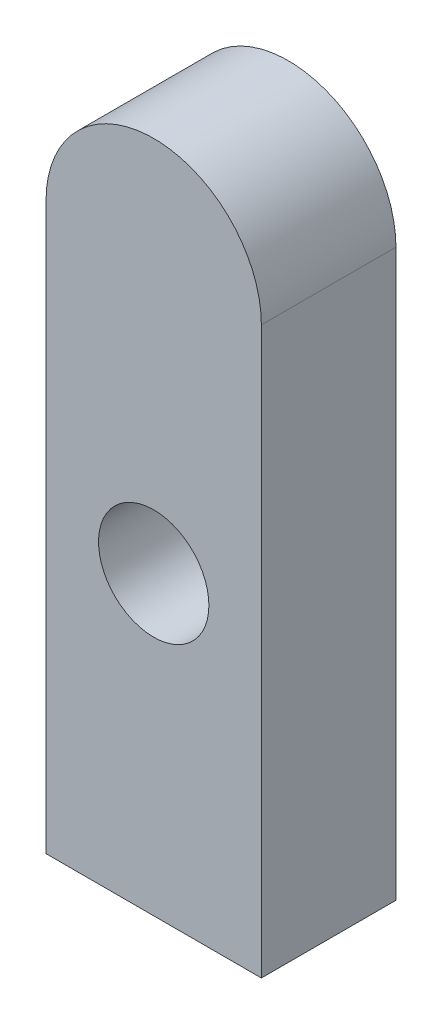
from build123d import *

# Parameters (mm, degrees)
SKETCH_1_R      = 2.05
EXTRUDE_1_DEPTH = 2.5


with BuildPart() as part:
    # 스케치1 → 보스-돌출1 (new, symmetric)
    with BuildSketch(Plane.XY):
        with BuildLine():
            Line((-4, 0), (-4, 10))
            ThreePointArc((-4, 10), (0, 14), (4, 10))
            Line((4, 10), (4, 0))
            Line((4, 0), (4, -11.014558485))
            Line((4, -11.014558485), (-4, -11.014558485))
            Line((-4, -11.014558485), (-4, 0))
        make_face()
        Circle(SKETCH_1_R, mode=Mode.SUBTRACT)
    extrude(amount=EXTRUDE_1_DEPTH, both=True)


solid = part.part
